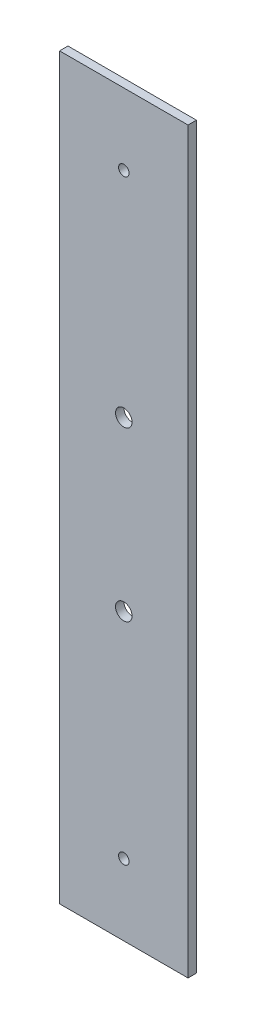
from build123d import *

# Parameters (mm, degrees)
SKETCH1_W           = 38.862
SKETCH1_H           = 228.6
BOSS_EXTRUDE1_DEPTH = 2.54
SKETCH2_R           = 1.5875
CUT_EXTRUDE1_DEPTH  = 116.967691022
SKETCH3_R           = 2.5
CUT_EXTRUDE2_DEPTH  = 5.08
SKETCH4_W           = 38.862
SKETCH4_H           = 2.54
CUT_EXTRUDE3_DEPTH  = 116.967691022


with BuildPart() as part:
    # Sketch1 → Boss-Extrude1 (new body)
    with BuildSketch(Plane.XY):
        Rectangle(SKETCH1_W, SKETCH1_H)
    extrude(amount=BOSS_EXTRUDE1_DEPTH)

    # Sketch2 → Cut-Extrude1 (cut, through all)
    with BuildSketch(Plane.XY.offset(2.54)):
        with Locations((0, -90.17)):
            Circle(SKETCH2_R)
    cut_extrude1 = extrude(amount=-CUT_EXTRUDE1_DEPTH, mode=Mode.SUBTRACT)

    # Mirror1: Cut-Extrude1 across plane
    add(cut_extrude1.mirror(Plane.ZX), mode=Mode.SUBTRACT)

    # Sketch3 → Cut-Extrude2 (cut)
    with BuildSketch(Plane.XY.offset(2.54)):
        with Locations((0, -25.4)):
            Circle(SKETCH3_R)
        with Locations((0, 25.4)):
            Circle(SKETCH3_R)
    extrude(amount=-CUT_EXTRUDE2_DEPTH, mode=Mode.SUBTRACT)

    # Sketch4 → Cut-Extrude3 (cut, through all)
    with BuildSketch(Plane.XY.offset(2.54)):
        with Locations((0, 113.03)):
            Rectangle(SKETCH4_W, SKETCH4_H)
        with Locations((0, -113.03)):
            Rectangle(SKETCH4_W, SKETCH4_H)
    extrude(amount=-CUT_EXTRUDE3_DEPTH, mode=Mode.SUBTRACT)


solid = part.part
